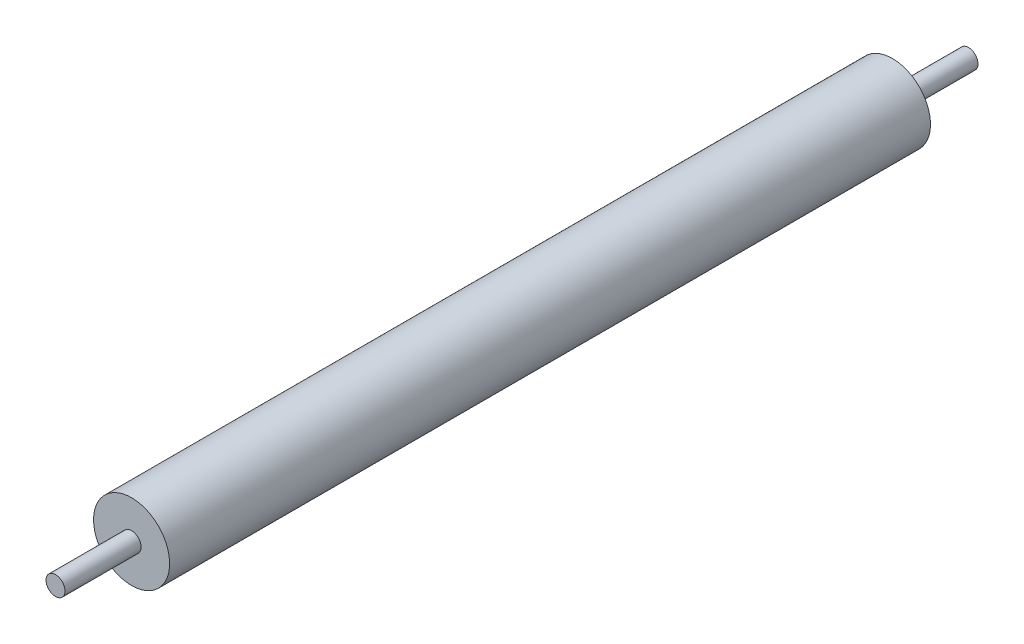
from build123d import *


with BuildPart() as part:
    # Sketch1 → Revolve1 (revolve)
    with BuildSketch(Plane(origin=(0, 0, 0), x_dir=(1, 0, 0), z_dir=(0, 1, 0))):
        Polygon((0, -120), (-2.5, -120), (-2.5, -100), (-10, -100), (-10, 100), (-2.5, 100), (-2.5, 120), (0, 120), align=None)
    revolve(axis=Axis((0, 0, -120), (0, 0, 1)))


solid = part.part
